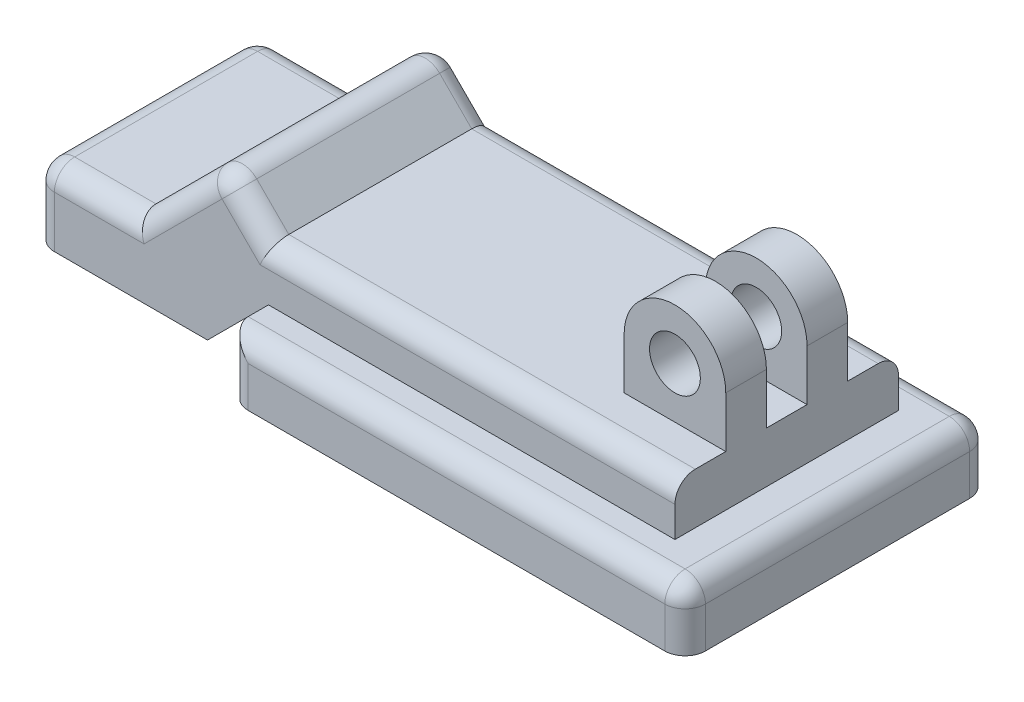
from build123d import *

# Parameters (mm, degrees)
BOSS_EXTRUDE1_DEPTH = 30
BOSS_EXTRUDE2_DEPTH = 30
SKETCH2_5_W         = 200
SKETCH2_5_H         = 30
BOSS_EXTRUDE3_DEPTH = 75
SKETCH2_6_W         = 200
SKETCH2_6_H         = 30
BOSS_EXTRUDE4_DEPTH = 75
SKETCH3_R           = 12.5
BOSS_EXTRUDE5_DEPTH = 20
BOSS_EXTRUDE6_START = -20
SKETCH4_R           = 12.5
BOSS_EXTRUDE6_DEPTH = 20
BOSS_EXTRUDE7_DEPTH = 25
BOSS_EXTRUDE8_DEPTH = 25
SKETCH7_W           = 150
SKETCH7_H           = 30
BOSS_EXTRUDE9_DEPTH = 25
FILLET1_R           = 10


with BuildPart() as part:
    # Sketch2 → Boss-Extrude1 (new body)
    with BuildSketch(Plane.XY):
        Polygon((-130, -30), (-100, 0), (100, 0), (100, 25), (-100, 25), (-122.855339059, 47.855339059), (-165.355339059, 5.355339059), (-215.355339059, 5.355339059), (-215.355339059, -30), align=None)
    extrude(amount=BOSS_EXTRUDE1_DEPTH)

    # Sketch2<4> → Boss-Extrude2 (add)
    with BuildSketch(Plane.XY):
        Polygon((-130, -30), (-100, 0), (100, 0), (100, 25), (-100, 25), (-122.855339059, 47.855339059), (-165.355339059, 5.355339059), (-215.355339059, 5.355339059), (-215.355339059, -30), align=None)
    extrude(amount=-BOSS_EXTRUDE2_DEPTH)

    # Sketch2<5> → Boss-Extrude3 (add)
    with BuildSketch(Plane.XY):
        with Locations((0, -15)):
            Rectangle(SKETCH2_5_W, SKETCH2_5_H)
    extrude(amount=BOSS_EXTRUDE3_DEPTH)

    # Sketch2<6> → Boss-Extrude4 (add)
    with BuildSketch(Plane.XY):
        with Locations((0, -15)):
            Rectangle(SKETCH2_6_W, SKETCH2_6_H)
    extrude(amount=-BOSS_EXTRUDE4_DEPTH)

    # Sketch3 → Boss-Extrude5 (add)
    with BuildSketch(Plane.XY.offset(30)):
        with BuildLine():
            Line((100, 25), (50, 25))
            Line((50, 25), (50, 50))
            ThreePointArc((50, 50), (75, 75), (100, 50))
            Line((100, 50), (100, 25))
        make_face()
        with Locations((75, 50)):
            Circle(SKETCH3_R, mode=Mode.SUBTRACT)
    extrude(amount=-BOSS_EXTRUDE5_DEPTH)

    # Sketch4 → Boss-Extrude6 (add)
    with BuildSketch(Plane(origin=(0, 0, -30), x_dir=(-1, 0, 0), z_dir=(0, 0, -1)).offset(BOSS_EXTRUDE6_START)):
        with BuildLine():
            Line((-100, 25), (-50, 25))
            Line((-50, 25), (-50, 50))
            ThreePointArc((-50, 50), (-75, 75), (-100, 50))
            Line((-100, 50), (-100, 25))
        make_face()
        with Locations((-75, 50)):
            Circle(SKETCH4_R, mode=Mode.SUBTRACT)
    extrude(amount=BOSS_EXTRUDE6_DEPTH)

    # Sketch5 → Boss-Extrude7 (add)
    with BuildSketch(Plane(origin=(0, 0, -30), x_dir=(-1, 0, 0), z_dir=(0, 0, -1))):
        Polygon((122.855339059, 47.855339059), (100, 25), (-100, 25), (-100, 0), (100, 0), (130, -30), (215.355339059, -30), (215.355339059, 5.355339059), (165.355339059, 5.355339059), align=None)
    extrude(amount=BOSS_EXTRUDE7_DEPTH)

    # Sketch6 → Boss-Extrude8 (add)
    with BuildSketch(Plane.XY.offset(30)):
        Polygon((-122.855339059, 47.855339059), (-100, 25), (100, 25), (100, 0), (-100, 0), (-130, -30), (-215.355339059, -30), (-215.355339059, 5.355339059), (-165.355339059, 5.355339059), align=None)
    extrude(amount=BOSS_EXTRUDE8_DEPTH)

    # Sketch7 → Boss-Extrude9 (add)
    with BuildSketch(Plane(origin=(100, 0, 0), x_dir=(0, 0, -1), z_dir=(1, 0, 0))):
        with Locations((0, -15)):
            Rectangle(SKETCH7_W, SKETCH7_H)
    extrude(amount=BOSS_EXTRUDE9_DEPTH)

    # Fillet1
    fillet1_edges = [part.edges().sort_by_distance(p)[0] for p in [
        (-122.855339059, 47.855339059, 0),
        (-215.355339059, 5.355339059, 0),
        (-215.355339059, -12.32233047, -55),
        (-190.355339059, 5.355339059, -55),
        (-144.105339059, 26.605339059, -55),
        (-111.42766953, 36.42766953, -55),
        (0, 25, -55),
        (-100, -15, -75),
        (12.5, 0, -75),
        (-215.355339059, -12.32233047, 55),
        (-190.355339059, 5.355339059, 55),
        (-144.105339059, 26.605339059, 55),
        (-111.42766953, 36.42766953, 55),
        (0, 25, 55),
        (-100, -15, 75),
        (125, 0, 0),
        (12.5, 0, 75),
        (125, -15, -75),
        (125, -15, 75),
    ]]
    fillet(fillet1_edges, radius=FILLET1_R)


solid = part.part
